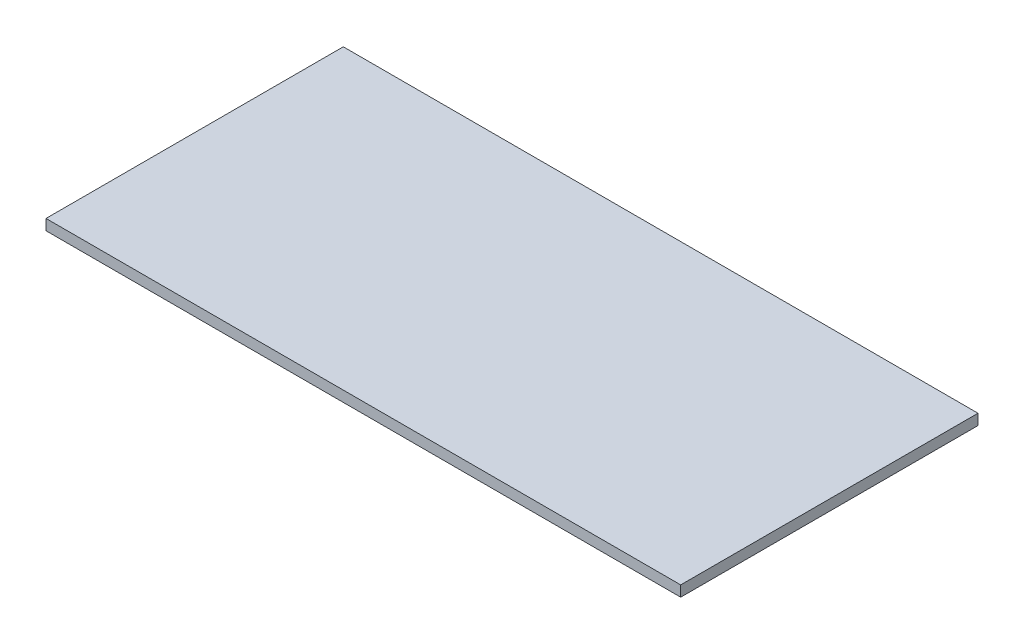
from build123d import *

# Parameters (mm, degrees)
SKETCH1_W           = 190
SKETCH1_H           = 89
BOSS_EXTRUDE1_DEPTH = 3.2


with BuildPart() as part:
    # Sketch1 → Boss-Extrude1 (new body)
    with BuildSketch(Plane(origin=(0, 0, 0), x_dir=(1, 0, 0), z_dir=(0, 1, 0))):
        Rectangle(SKETCH1_W, SKETCH1_H)
    extrude(amount=BOSS_EXTRUDE1_DEPTH)


solid = part.part
